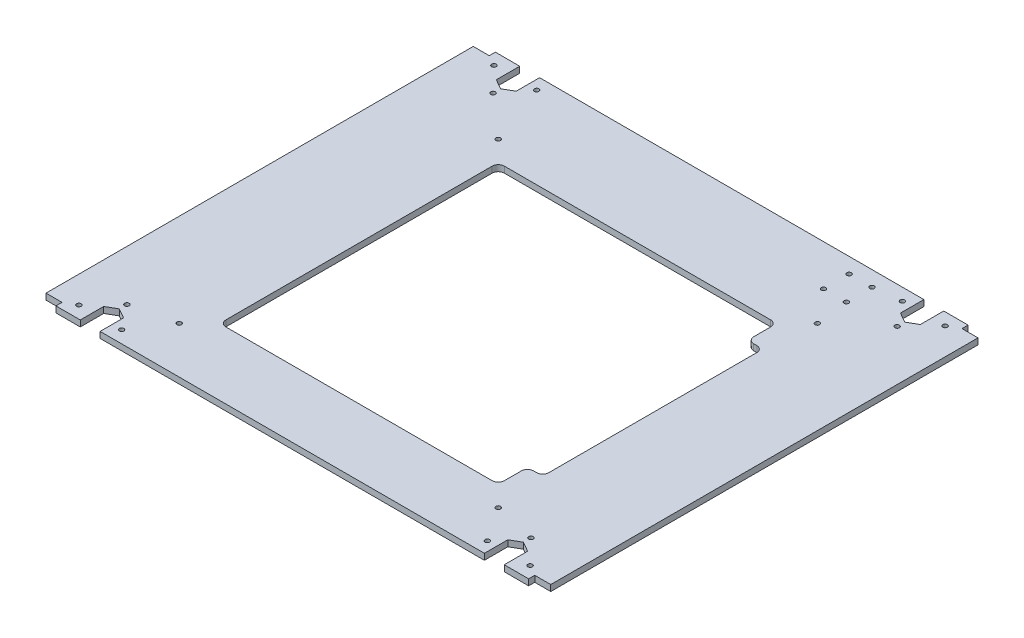
from build123d import *

# Parameters (mm, degrees)
SKETCH1_R               = 1.5
SKETCH1_W               = 182.468094358
SKETCH1_H               = 182.468094358
BOSS_EXTRUDE1_DEPTH     = 4
CUT_EXTRUDE1_DEPTH      = 10
CUT_EXTRUDE1_DEPTH_BACK = 10
SKETCH7_W               = 144.235193926
SKETCH7_H               = 4
FILLET1_R               = 4


with BuildPart() as part:
    # Sketch1 → Boss-Extrude1 (new body)
    with BuildSketch(Plane(origin=(0, 0, 0), x_dir=(1, 0, 0), z_dir=(0, 1, 0))):
        Polygon((154.855, -139.95), (165.325, -139.95), (165.325, 139.95), (154.855, 139.95), (154.855, 143.95), (138.875, 143.95), (138.875, 128.61722325), (132.375, 124.864446501), (125.875, 128.61722325), (125.875, 143.95), (-125.875, 143.95), (-125.875, 128.61722325), (-132.375, 124.864446501), (-138.875, 128.61722325), (-138.875, 143.95), (-154.855, 143.95), (-154.855, 139.95), (-165.325, 139.95), (-165.325, -139.95), (-154.855, -139.95), (-154.855, -143.95), (-138.875, -143.95), (-138.875, -128.61722325), (-132.375, -124.864446501), (-125.875, -128.61722325), (-125.875, -143.95), (125.875, -143.95), (125.875, -128.61722325), (132.375, -124.864446501), (138.875, -128.61722325), (138.875, -143.95), (154.855, -143.95), align=None)
        with Locations((-147.795, -135.95)):
            Circle(SKETCH1_R, mode=Mode.SUBTRACT)
        with Locations((-132.375, -119.95)):
            Circle(SKETCH1_R, mode=Mode.SUBTRACT)
        with Locations((-119.795, -135.95)):
            Circle(SKETCH1_R, mode=Mode.SUBTRACT)
        with Locations((-104.5, -113.5)):
            Circle(SKETCH1_R, mode=Mode.SUBTRACT)
        with Locations((0, -9)):
            Rectangle(SKETCH1_W, SKETCH1_H, mode=Mode.SUBTRACT)
        with Locations((119.795, -135.95)):
            Circle(SKETCH1_R, mode=Mode.SUBTRACT)
        with Locations((104.5, -113.5)):
            Circle(SKETCH1_R, mode=Mode.SUBTRACT)
        with Locations((147.795, -135.95)):
            Circle(SKETCH1_R, mode=Mode.SUBTRACT)
        with Locations((132.375, -119.95)):
            Circle(SKETCH1_R, mode=Mode.SUBTRACT)
        with Locations((-104.5, 95.5)):
            Circle(SKETCH1_R, mode=Mode.SUBTRACT)
        with Locations((-132.375, 119.95)):
            Circle(SKETCH1_R, mode=Mode.SUBTRACT)
        with Locations((-147.795, 135.95)):
            Circle(SKETCH1_R, mode=Mode.SUBTRACT)
        with Locations((-119.795, 135.95)):
            Circle(SKETCH1_R, mode=Mode.SUBTRACT)
        with Locations((104.5, 95.5)):
            Circle(SKETCH1_R, mode=Mode.SUBTRACT)
        with Locations((86.915968312, 117.1513625)):
            Circle(SKETCH1_R, mode=Mode.SUBTRACT)
        with Locations((101.875, 117.1513625)):
            Circle(SKETCH1_R, mode=Mode.SUBTRACT)
        with Locations((86.915968312, 133.95)):
            Circle(SKETCH1_R, mode=Mode.SUBTRACT)
        with Locations((101.875, 133.95)):
            Circle(SKETCH1_R, mode=Mode.SUBTRACT)
        with Locations((119.795, 135.95)):
            Circle(SKETCH1_R, mode=Mode.SUBTRACT)
        with Locations((132.375, 119.95)):
            Circle(SKETCH1_R, mode=Mode.SUBTRACT)
        with Locations((147.795, 135.95)):
            Circle(SKETCH1_R, mode=Mode.SUBTRACT)
    extrude(amount=BOSS_EXTRUDE1_DEPTH)

    # Sketch7 → Cut-Extrude1 (cut, two sides: drawn at the far end of the back side and taken through both)
    with BuildSketch(Plane.ZY.offset(-91.234047179).offset(-CUT_EXTRUDE1_DEPTH_BACK)):
        with Locations((9, 2)):
            Rectangle(SKETCH7_W, SKETCH7_H)
    extrude(amount=CUT_EXTRUDE1_DEPTH + CUT_EXTRUDE1_DEPTH_BACK, mode=Mode.SUBTRACT)

    # Fillet1
    fillet1_edges = [part.edges().sort_by_distance(p)[0] for p in [
        (101.234047179, 2, -63.117596963),
        (101.234047179, 2, 81.117596963),
        (91.234047179, 2, 100.234047179),
        (-91.234047179, 2, 100.234047179),
        (-91.234047179, 2, -82.234047179),
        (91.234047179, 2, -82.234047179),
        (91.234047179, 2, -63.117596963),
        (91.234047179, 2, 81.117596963),
    ]]
    fillet(fillet1_edges, radius=FILLET1_R)


solid = part.part
